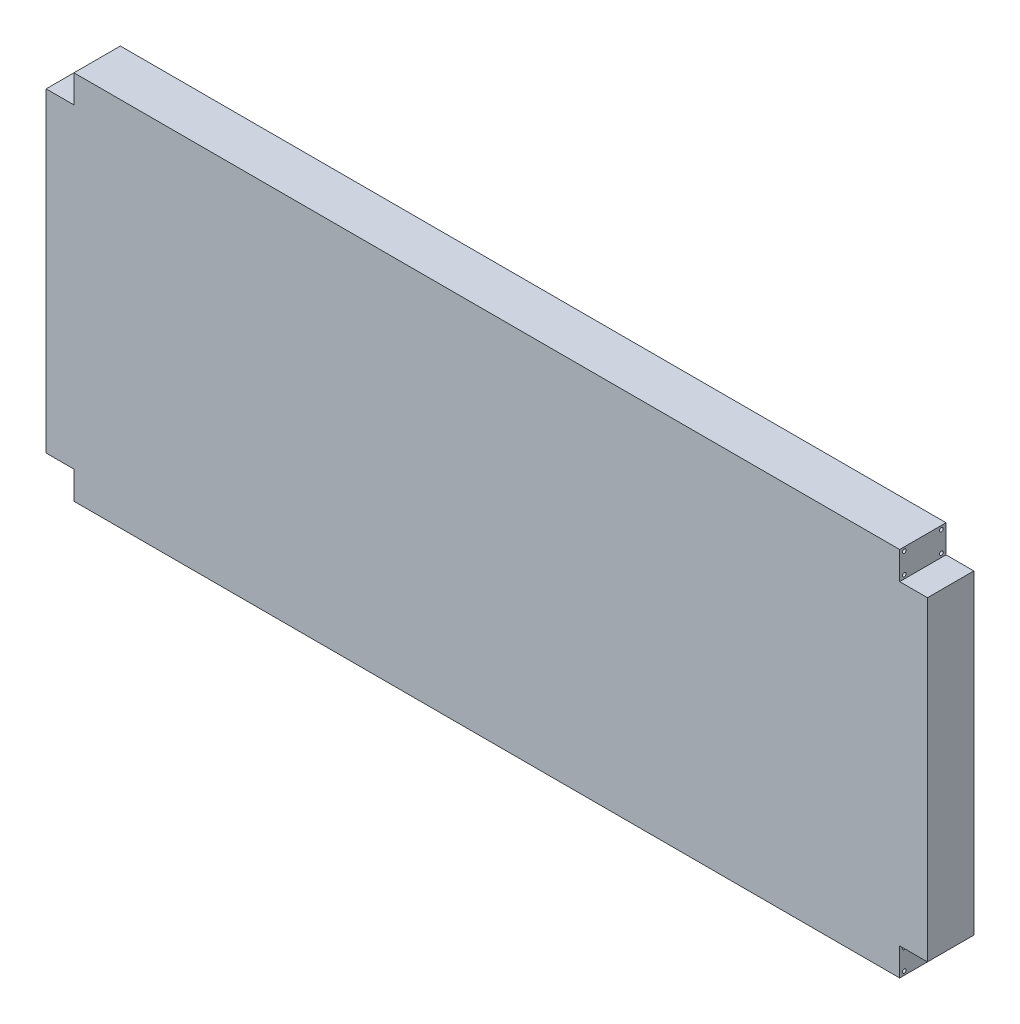
from build123d import *

# Parameters (mm, degrees)
SKETCH1_W                 = 950
SKETCH1_H                 = 400
BOSS_EXTRUDE1_DEPTH       = 50
SKETCH2_W                 = 30
SKETCH2_H                 = 30
CUT_EXTRUDE1_DEPTH        = 518.80787943
F_4_0MM_DOWEL_HOLE1_D     = 4
F_4_0MM_DOWEL_HOLE1_DEPTH = 30
F_4_0MM_DOWEL_HOLE1_TIP   = 1.201721238
F_4_0MM_DOWEL_HOLE2_D     = 4
F_4_0MM_DOWEL_HOLE2_DEPTH = 30
F_4_0MM_DOWEL_HOLE2_TIP   = 1.201721238
F_4_0MM_DOWEL_HOLE3_D     = 4
F_4_0MM_DOWEL_HOLE3_DEPTH = 30
F_4_0MM_DOWEL_HOLE3_TIP   = 1.201721238
F_4_0MM_DOWEL_HOLE4_D     = 4
F_4_0MM_DOWEL_HOLE4_DEPTH = 30
F_4_0MM_DOWEL_HOLE4_TIP   = 1.201721238


with BuildPart() as part:
    # Sketch1 → Boss-Extrude1 (new body)
    with BuildSketch(Plane.XY):
        Rectangle(SKETCH1_W, SKETCH1_H)
    extrude(amount=BOSS_EXTRUDE1_DEPTH)

    # Sketch2 → Cut-Extrude1 (cut, through all)
    with BuildSketch(Plane.XY.offset(50)):
        with Locations((-460, 185)):
            Rectangle(SKETCH2_W, SKETCH2_H)
        with Locations((-460, -185)):
            Rectangle(SKETCH2_W, SKETCH2_H)
        with Locations((460, -185)):
            Rectangle(SKETCH2_W, SKETCH2_H)
        with Locations((460, 185)):
            Rectangle(SKETCH2_W, SKETCH2_H)
    extrude(amount=-CUT_EXTRUDE1_DEPTH, mode=Mode.SUBTRACT)

    # Ø4.0mm Dowel Hole1
    with Locations(Plane(origin=(445, -196, 45), x_dir=(0, 0, 1), z_dir=(1, 0, 0))):
        with Locations((0, 0), (0, -22), (-40, 0), (-40, -22)):
            Hole(F_4_0MM_DOWEL_HOLE1_D / 2, depth=F_4_0MM_DOWEL_HOLE1_DEPTH)
            with Locations((0, 0, -(F_4_0MM_DOWEL_HOLE1_DEPTH + F_4_0MM_DOWEL_HOLE1_TIP / 2))):  # 118° drill point
                Cone(0, F_4_0MM_DOWEL_HOLE1_D / 2, F_4_0MM_DOWEL_HOLE1_TIP, mode=Mode.SUBTRACT)

    # Ø4.0mm Dowel Hole2
    with Locations(Plane(origin=(-445, -174, 5), x_dir=(0, 0, -1), z_dir=(-1, 0, 0))):
        with Locations((0, 0), (-40, 0), (-40, 22), (0, 22)):
            Hole(F_4_0MM_DOWEL_HOLE2_D / 2, depth=F_4_0MM_DOWEL_HOLE2_DEPTH)
            with Locations((0, 0, -(F_4_0MM_DOWEL_HOLE2_DEPTH + F_4_0MM_DOWEL_HOLE2_TIP / 2))):  # 118° drill point
                Cone(0, F_4_0MM_DOWEL_HOLE2_D / 2, F_4_0MM_DOWEL_HOLE2_TIP, mode=Mode.SUBTRACT)

    # Ø4.0mm Dowel Hole3
    with Locations(Plane(origin=(-445, 174, 45), x_dir=(0, 0, -1), z_dir=(-1, 0, 0))):
        with Locations((0, 0), (0, -22), (40, -22), (40, 0)):
            Hole(F_4_0MM_DOWEL_HOLE3_D / 2, depth=F_4_0MM_DOWEL_HOLE3_DEPTH)
            with Locations((0, 0, -(F_4_0MM_DOWEL_HOLE3_DEPTH + F_4_0MM_DOWEL_HOLE3_TIP / 2))):  # 118° drill point
                Cone(0, F_4_0MM_DOWEL_HOLE3_D / 2, F_4_0MM_DOWEL_HOLE3_TIP, mode=Mode.SUBTRACT)

    # Ø4.0mm Dowel Hole4
    with Locations(Plane(origin=(445, 174, 45), x_dir=(0, 0, 1), z_dir=(1, 0, 0))):
        with Locations((0, 0), (0, -22), (-40, 0), (-40, -22)):
            Hole(F_4_0MM_DOWEL_HOLE4_D / 2, depth=F_4_0MM_DOWEL_HOLE4_DEPTH)
            with Locations((0, 0, -(F_4_0MM_DOWEL_HOLE4_DEPTH + F_4_0MM_DOWEL_HOLE4_TIP / 2))):  # 118° drill point
                Cone(0, F_4_0MM_DOWEL_HOLE4_D / 2, F_4_0MM_DOWEL_HOLE4_TIP, mode=Mode.SUBTRACT)


solid = part.part
